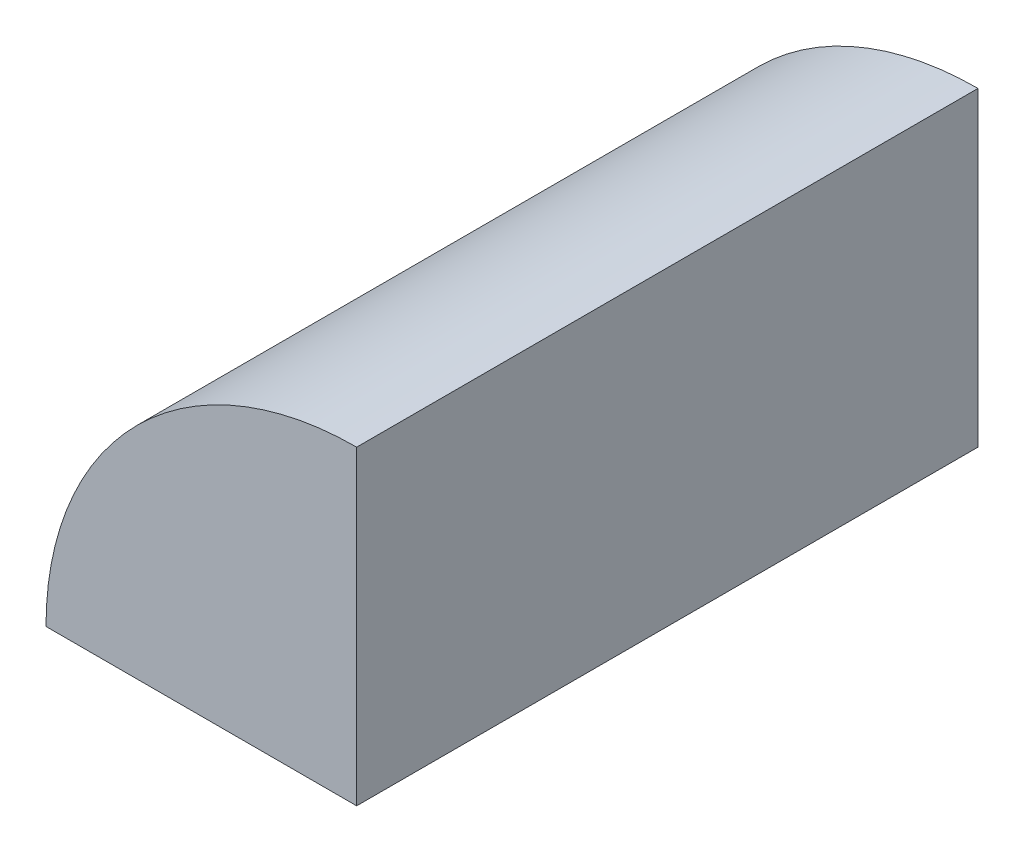
from build123d import *

# Parameters (mm, degrees)
SALIENTE_EXTRUIR1_DEPTH = 50
CROQUIS2_R              = 5
CORTAR_EXTRUIR1_DEPTH   = 10


with BuildPart() as part:
    # Croquis1 → Saliente-Extruir1 (new body)
    with BuildSketch(Plane.XY):
        with BuildLine():
            Line((0, 25), (0, 0))
            Line((0, 0), (-25, 0))
            ThreePointArc((-25, 0), (-17.67766953, 17.67766953), (0, 25))
        make_face()
    extrude(amount=SALIENTE_EXTRUIR1_DEPTH)

    # Croquis2 → Cortar-Extruir1 (cut)
    with BuildSketch(Plane(origin=(0, 0, 0), x_dir=(-1, 0, 0), z_dir=(0, 0, -1))):
        with Locations((10.788171982, 10.388745444)):
            Circle(CROQUIS2_R)
    extrude(amount=-CORTAR_EXTRUIR1_DEPTH, mode=Mode.SUBTRACT)


solid = part.part
